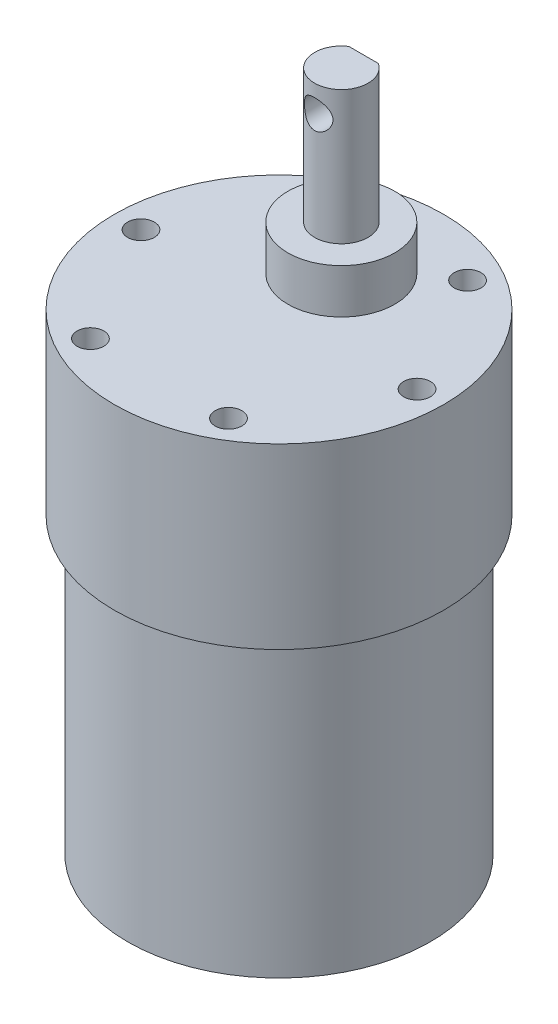
from build123d import *

# Parameters (mm, degrees)
SKETCH1_R           = 17
BOSS_EXTRUDE1_DEPTH = 33
SKETCH2_R           = 18.5
BOSS_EXTRUDE2_DEPTH = 20
SKETCH3_R           = 6
BOSS_EXTRUDE3_DEPTH = 5
SKETCH4_R           = 3
BOSS_EXTRUDE4_DEPTH = 15
CUT_EXTRUDE1_START  = -14
CUT_EXTRUDE1_DEPTH  = 14
SKETCH6_R           = 1.5
CUT_EXTRUDE2_DEPTH  = 10
SKETCH7_R           = 1.6
CUT_EXTRUDE3_DEPTH  = 10


with BuildPart() as part:
    # Sketch1 → Boss-Extrude1 (new body)
    with BuildSketch(Plane(origin=(0, 0, 0), x_dir=(1, 0, 0), z_dir=(0, 1, 0))):
        with Locations(Location((0, 0, 0), (0, 0, 270))):
            Circle(SKETCH1_R)
    extrude(amount=BOSS_EXTRUDE1_DEPTH)

    # Sketch2 → Boss-Extrude2 (add)
    with BuildSketch(Plane(origin=(0, 33, 0), x_dir=(1, 0, 0), z_dir=(0, 1, 0))):
        with Locations(Location((0, 0, 0), (0, 0, 270))):
            Circle(SKETCH2_R)
    extrude(amount=BOSS_EXTRUDE2_DEPTH)

    # Sketch3 → Boss-Extrude3 (add)
    with BuildSketch(Plane(origin=(0, 53, 0), x_dir=(1, 0, 0), z_dir=(0, 1, 0))):
        with Locations(Location((0, 7, 0), (0, 0, 270))):
            Circle(SKETCH3_R)
    extrude(amount=BOSS_EXTRUDE3_DEPTH)

    # Sketch4 → Boss-Extrude4 (add)
    with BuildSketch(Plane(origin=(0, 58, 0), x_dir=(1, 0, 0), z_dir=(0, 1, 0))):
        with Locations(Location((0, 7, 0), (0, 0, 270))):
            Circle(SKETCH4_R)
    extrude(amount=BOSS_EXTRUDE4_DEPTH)

    # Sketch5 → Cut-Extrude1 (cut)
    with BuildSketch(Plane(origin=(0, 73, 0), x_dir=(1, 0, 0), z_dir=(0, 1, 0)).offset(CUT_EXTRUDE1_START)):
        with BuildLine():
            Line((-1.658312395, 9.5), (1.658312395, 9.5))
            ThreePointArc((1.658312395, 9.5), (0, 10), (-1.658312395, 9.5))
        make_face()
    extrude(amount=CUT_EXTRUDE1_DEPTH, mode=Mode.SUBTRACT)

    # Sketch6 → Cut-Extrude2 (cut)
    with BuildSketch(Plane(origin=(0, 53, 0), x_dir=(1, 0, 0), z_dir=(0, 1, 0))):
        with Locations(Location((15.5, 0, 0), (0, 0, 270))):
            Circle(SKETCH6_R)
        with Locations(Location((-15.5, 0, 0), (0, 0, 270))):
            Circle(SKETCH6_R)
        with Locations(Location((-7.75, -13.423393759, 0), (0, 0, 270))):
            Circle(SKETCH6_R)
        with Locations(Location((7.75, -13.423393759, 0), (0, 0, 270))):
            Circle(SKETCH6_R)
        with Locations(Location((-7.75, 13.423393759, 0), (0, 0, 270))):
            Circle(SKETCH6_R)
        with Locations(Location((7.75, 13.423393759, 0), (0, 0, 270))):
            Circle(SKETCH6_R)
    extrude(amount=-CUT_EXTRUDE2_DEPTH, mode=Mode.SUBTRACT)

    # Sketch7 → Cut-Extrude3 (cut)
    with BuildSketch(Plane(origin=(0, 0, -9.5), x_dir=(-1, 0, 0), z_dir=(0, 0, -1))):
        with Locations((0, 70)):
            Circle(SKETCH7_R)
    extrude(amount=-CUT_EXTRUDE3_DEPTH, mode=Mode.SUBTRACT)


solid = part.part
